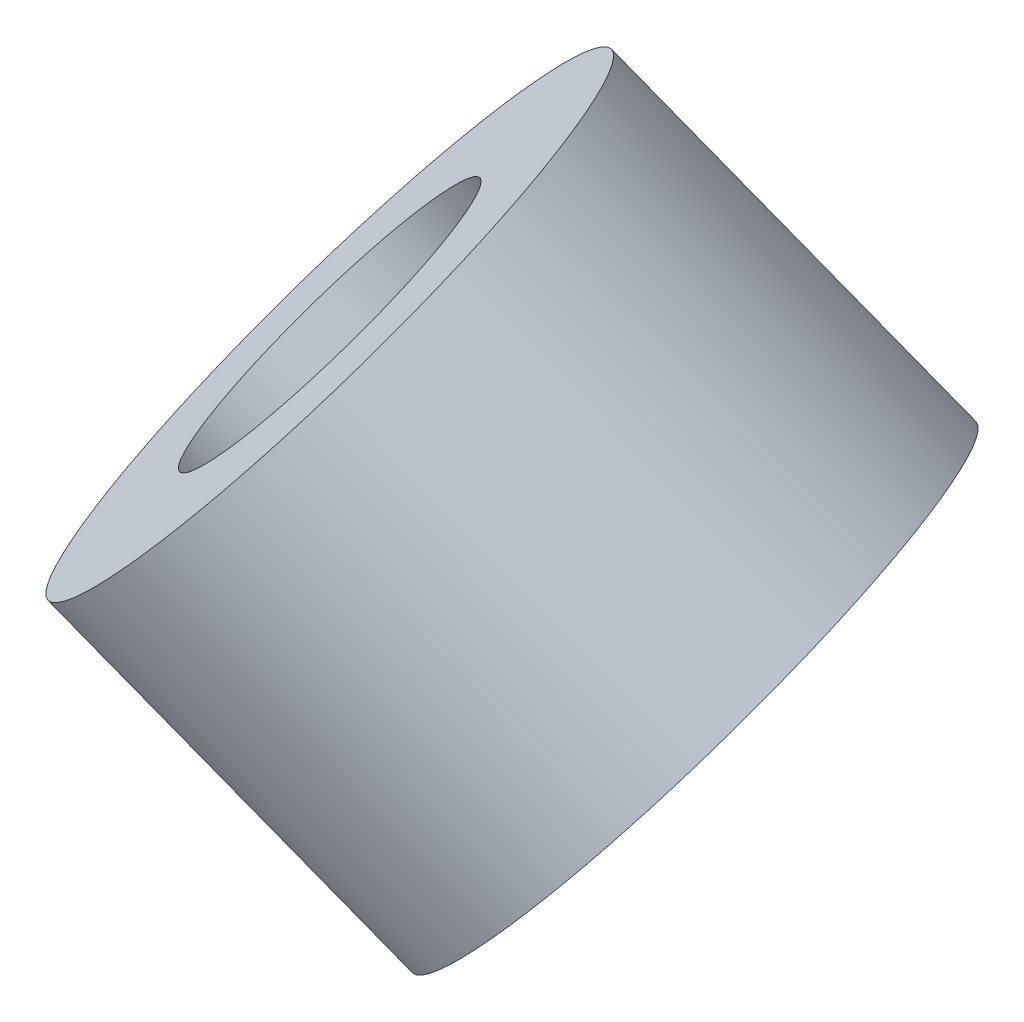
from build123d import *

# Parameters (mm, degrees)
SKETCH_1_R      = 3.75
SKETCH_1_R_2    = 2
EXTRUDE_1_DEPTH = 5


with BuildPart() as part:
    # Эскиз1 → Бобышка-Вытянуть1 (new body)
    with BuildSketch(Plane(origin=(179.839710714, -166.431048635, -70.219226594), x_dir=(0.609726944998615, 0.36117470129410584, 0.7055394302856286), z_dir=(-0.7055394302856286, 0.6529351430211373, 0.2754810543761542))):
        with Locations(Location((24.516989087, 65.05719771, 0), (0, 0, 227.217559742))):
            Circle(SKETCH_1_R)
        with Locations(Location((24.516989087, 65.05719771, 0), (0, 0, 227.217559742))):
            Circle(SKETCH_1_R_2, mode=Mode.SUBTRACT)
    extrude(amount=-EXTRUDE_1_DEPTH)


solid = part.part
